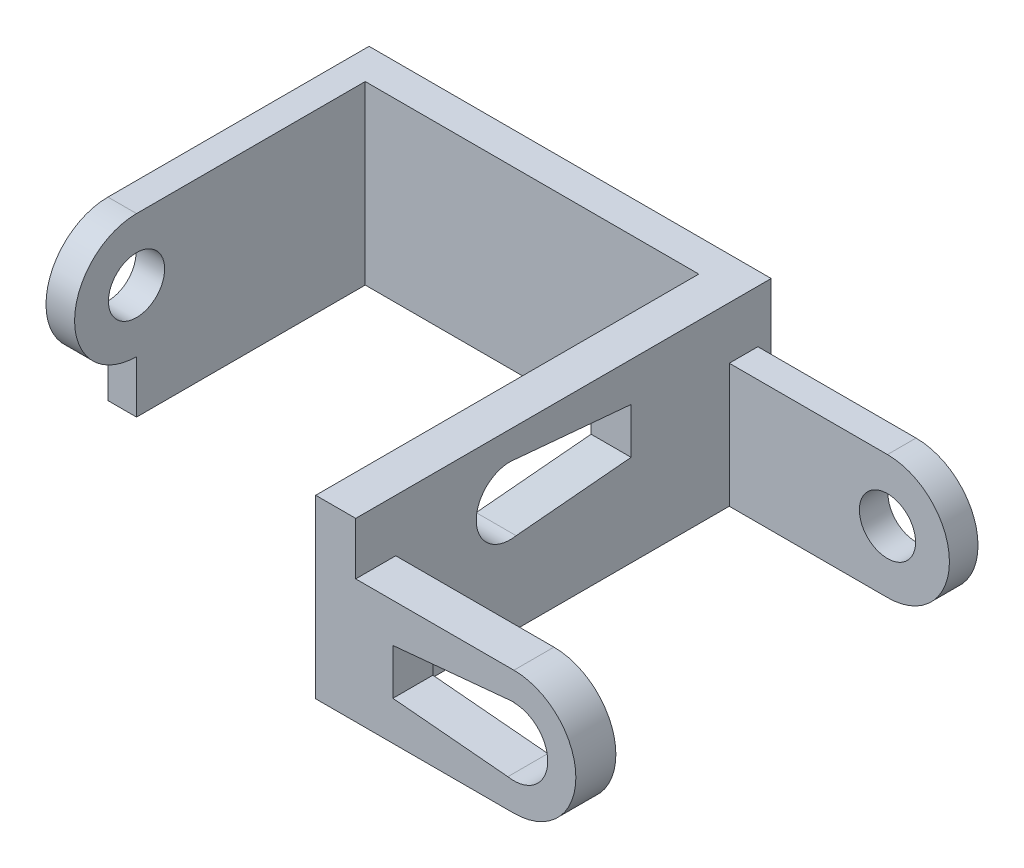
from build123d import *

# Parameters (mm, degrees)
BOSS_EXTRUDE1_START = -34.9
SKETCH1_W           = 43.6
SKETCH1_H           = 18.5
BOSS_EXTRUDE1_DEPTH = 2.1
CUT_EXTRUDE1_START  = -34.9
SKETCH2_R           = 3.55
CUT_EXTRUDE1_DEPTH  = 2.1
CUT_EXTRUDE2_START  = -34.9
CUT_EXTRUDE2_DEPTH  = 2.1
BOSS_EXTRUDE2_START = 14.1
SKETCH4_R           = 6.5
BOSS_EXTRUDE2_DEPTH = 2.1
BOSS_EXTRUDE3_START = 14.1
SKETCH5_W           = 20.8
SKETCH5_H           = 13
BOSS_EXTRUDE3_DEPTH = 2.1
CUT_EXTRUDE3_START  = 14.1
SKETCH6_R           = 3.55
CUT_EXTRUDE3_DEPTH  = 2.1
CUT_EXTRUDE4_START  = 14.1
CUT_EXTRUDE4_DEPTH  = 2.1
BOSS_EXTRUDE4_START = -24.5
SKETCH8_R           = 6.5
BOSS_EXTRUDE4_DEPTH = 1.5
BOSS_EXTRUDE5_START = -24.5
SKETCH9_W           = 20.8
SKETCH9_H           = 13
BOSS_EXTRUDE5_DEPTH = 1.5
CUT_EXTRUDE5_START  = -24.5
SKETCH10_R          = 2.95
CUT_EXTRUDE5_DEPTH  = 1.5
BOSS_EXTRUDE6_START = -25.7
SKETCH11_W          = 42.2
SKETCH11_H          = 18.5
BOSS_EXTRUDE6_DEPTH = 1.7
BOSS_EXTRUDE7_START = -73.5
SKETCH12_R          = 6.5
BOSS_EXTRUDE7_DEPTH = 1.5
BOSS_EXTRUDE8_START = -73.5
SKETCH13_W          = 27.4
SKETCH13_H          = 18.5
BOSS_EXTRUDE8_DEPTH = 1.5
CUT_EXTRUDE6_START  = -73.5
SKETCH14_R          = 2.95
CUT_EXTRUDE6_DEPTH  = 1.5


with BuildPart() as part:
    # Sketch1 → Boss-Extrude1 (new, symmetric)
    with BuildSketch(Plane(origin=(0, 0, 0), x_dir=(0, 0, -1), z_dir=(1, 0, 0)).offset(BOSS_EXTRUDE1_START)):
        with Locations((5.6, 21.25)):
            Rectangle(SKETCH1_W, SKETCH1_H)
    extrude(amount=BOSS_EXTRUDE1_DEPTH, both=True)

    # Sketch2 → Cut-Extrude1 (cut, symmetric)
    with BuildSketch(Plane(origin=(0, 0, 0), x_dir=(0, 0, -1), z_dir=(1, 0, 0)).offset(CUT_EXTRUDE1_START)):
        with Locations((0, 24)):
            Circle(SKETCH2_R)
    extrude(amount=CUT_EXTRUDE1_DEPTH, both=True, mode=Mode.SUBTRACT)

    # Sketch3 → Cut-Extrude2 (cut, symmetric)
    with BuildSketch(Plane(origin=(0, 0, 0), x_dir=(0, 0, -1), z_dir=(1, 0, 0)).offset(CUT_EXTRUDE2_START)):
        Polygon((0, 20.45), (12.7, 21.596718595), (12.7, 26.403281405), (0, 27.55), align=None)
    extrude(amount=CUT_EXTRUDE2_DEPTH, both=True, mode=Mode.SUBTRACT)



with BuildPart() as body_2:
    # Sketch4 → Boss-Extrude2 (new, symmetric)
    with BuildSketch(Plane.XY.offset(BOSS_EXTRUDE2_START)):
        with Locations((-16.2, 18.5)):
            Circle(SKETCH4_R)
    extrude(amount=BOSS_EXTRUDE2_DEPTH, both=True)


with BuildPart() as part_1:
    add(part.part)

    add(body_2.part)  # Boss-Extrude3 merges body 2
    # Sketch5 → Boss-Extrude3 (add, symmetric)
    with BuildSketch(Plane.XY.offset(BOSS_EXTRUDE3_START)):
        with Locations((-26.6, 18.5)):
            Rectangle(SKETCH5_W, SKETCH5_H)
    extrude(amount=BOSS_EXTRUDE3_DEPTH, both=True)

    # Sketch6 → Cut-Extrude3 (cut, symmetric)
    with BuildSketch(Plane.XY.offset(CUT_EXTRUDE3_START)):
        with Locations((-16.2, 18.5)):
            Circle(SKETCH6_R)
    extrude(amount=CUT_EXTRUDE3_DEPTH, both=True, mode=Mode.SUBTRACT)

    # Sketch7 → Cut-Extrude4 (cut, symmetric)
    with BuildSketch(Plane.XY.offset(CUT_EXTRUDE4_START)):
        Polygon((-16.2, 22.103784861), (-28.9, 20.903281405), (-28.9, 16.096718595), (-16.2, 14.95), align=None)
    extrude(amount=CUT_EXTRUDE4_DEPTH, both=True, mode=Mode.SUBTRACT)



with BuildPart() as body_2_2:
    # Sketch8 → Boss-Extrude4 (new, symmetric)
    with BuildSketch(Plane.XY.offset(BOSS_EXTRUDE4_START)):
        with Locations(Location((-16.2, 18.5, 0), (0, 0, 180))):
            Circle(SKETCH8_R)
    extrude(amount=BOSS_EXTRUDE4_DEPTH, both=True)


with BuildPart() as part_2:
    add(part_1.part)

    add(body_2_2.part)  # Boss-Extrude5 merges body 2 2
    # Sketch9 → Boss-Extrude5 (add, symmetric)
    with BuildSketch(Plane.XY.offset(BOSS_EXTRUDE5_START)):
        with Locations((-26.6, 18.5)):
            Rectangle(SKETCH9_W, SKETCH9_H)
    extrude(amount=BOSS_EXTRUDE5_DEPTH, both=True)

    # Sketch10 → Cut-Extrude5 (cut, symmetric)
    with BuildSketch(Plane.XY.offset(CUT_EXTRUDE5_START)):
        with Locations((-16.2, 18.5)):
            Circle(SKETCH10_R)
    extrude(amount=CUT_EXTRUDE5_DEPTH, both=True, mode=Mode.SUBTRACT)

    # Sketch11 → Boss-Extrude6 (add, symmetric)
    with BuildSketch(Plane.XY.offset(BOSS_EXTRUDE6_START)):
        with Locations((-53.9, 21.25)):
            Rectangle(SKETCH11_W, SKETCH11_H)
    extrude(amount=BOSS_EXTRUDE6_DEPTH, both=True)



with BuildPart() as body_2_3:
    # Sketch12 → Boss-Extrude7 (new, symmetric)
    with BuildSketch(Plane(origin=(0, 0, 0), x_dir=(0, 0, -1), z_dir=(1, 0, 0)).offset(BOSS_EXTRUDE7_START)):
        with Locations((0, 24)):
            Circle(SKETCH12_R)
    extrude(amount=BOSS_EXTRUDE7_DEPTH, both=True)


with BuildPart() as part_3:
    add(part_2.part)

    add(body_2_3.part)  # Boss-Extrude8 merges body 2 3
    # Sketch13 → Boss-Extrude8 (add, symmetric)
    with BuildSketch(Plane(origin=(0, 0, 0), x_dir=(0, 0, -1), z_dir=(1, 0, 0)).offset(BOSS_EXTRUDE8_START)):
        with Locations((13.7, 21.25)):
            Rectangle(SKETCH13_W, SKETCH13_H)
    extrude(amount=BOSS_EXTRUDE8_DEPTH, both=True)

    # Sketch14 → Cut-Extrude6 (cut, symmetric)
    with BuildSketch(Plane(origin=(0, 0, 0), x_dir=(0, 0, -1), z_dir=(1, 0, 0)).offset(CUT_EXTRUDE6_START)):
        with Locations((0, 24)):
            Circle(SKETCH14_R)
    extrude(amount=CUT_EXTRUDE6_DEPTH, both=True, mode=Mode.SUBTRACT)


solid = part_3.part
